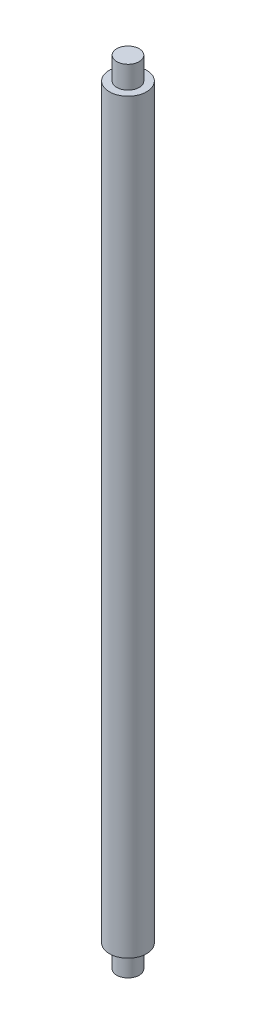
from build123d import *

# Parameters (mm, degrees)
SKETCH_1_R      = 2.5
EXTRUDE_2_DEPTH = 50
SKETCH_2_R      = 1.5
EXTRUDE_3_DEPTH = 3
EXTRUDE_START   = 3
SKETCH_3_R      = 1.5
EXTRUDE_4_DEPTH = 3


with BuildPart() as part:
    # 草图1 → 凸台-拉伸2 (new, symmetric)
    with BuildSketch(Plane(origin=(0, 0, 0), x_dir=(1, 0, 0), z_dir=(0, 1, 0))):
        with Locations(Location((0, 0, 0), (0, 0, 270))):
            Circle(SKETCH_1_R)
    extrude(amount=EXTRUDE_2_DEPTH, both=True)

    # 草图2 → 凸台-拉伸3 (add)
    with BuildSketch(Plane(origin=(0, 50, 0), x_dir=(1, 0, 0), z_dir=(0, 1, 0))):
        with Locations(Location((0, 0, 0), (0, 0, 270))):
            Circle(SKETCH_2_R)
    extrude(amount=EXTRUDE_3_DEPTH)

    # 草图3 → 凸台-拉伸4 (add)
    with BuildSketch(Plane.XZ.offset(50).offset(EXTRUDE_START)):
        with Locations(Location((0, 0, 0), (0, 0, 90))):
            Circle(SKETCH_3_R)
    extrude(amount=-EXTRUDE_4_DEPTH)


solid = part.part
